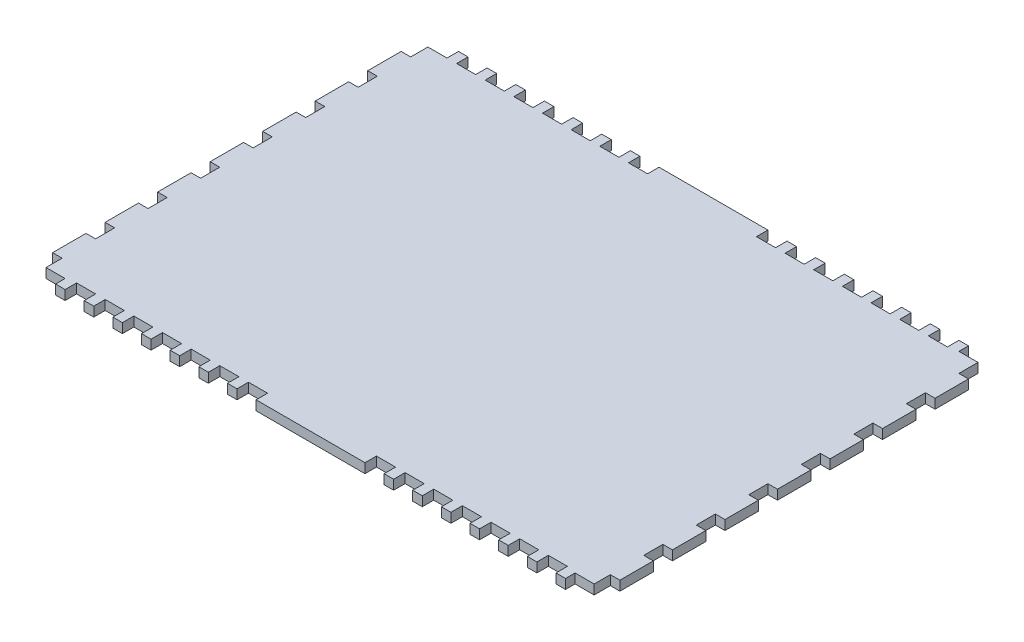
from build123d import *

# Parameters (mm, degrees)
ESQUISSE1_W                  = 297
ESQUISSE1_H                  = 210.950231097
BOSS_EXTRU_1_DEPTH           = 5
ESQUISSE2_W                  = 15
ESQUISSE2_H                  = 5
ENL_V_MAT_EXTRU_1_DEPTH      = 10
ESQUISSE3_W                  = 10
ESQUISSE3_H                  = 5
ESQUISSE3_H_2                = 1
ENL_V_MAT_EXTRU_2_DEPTH      = 10
R_P_TITION_LIN_AIRE1_COUNT   = 7
R_P_TITION_LIN_AIRE1_PITCH   = 15
SYM_TRIE1_COPY_1_SKETCH_W    = 10
SYM_TRIE1_COPY_1_SKETCH_H    = 5
SYM_TRIE1_COPY_1_SKETCH_H_2  = 1
SYM_TRIE1_COPY_1_DEPTH       = 10
SYM_TRIE1_COPY_2_SKETCH_W    = 10
SYM_TRIE1_COPY_2_SKETCH_H    = 5
SYM_TRIE1_COPY_2_SKETCH_H_2  = 1
SYM_TRIE1_COPY_2_DEPTH       = 10
SYM_TRIE1_COPY_3_SKETCH_W    = 10
SYM_TRIE1_COPY_3_SKETCH_H    = 5
SYM_TRIE1_COPY_3_SKETCH_H_2  = 1
SYM_TRIE1_COPY_3_DEPTH       = 10
SYM_TRIE1_COPY_4_SKETCH_W    = 10
SYM_TRIE1_COPY_4_SKETCH_H    = 5
SYM_TRIE1_COPY_4_SKETCH_H_2  = 1
SYM_TRIE1_COPY_4_DEPTH       = 10
SYM_TRIE1_COPY_5_SKETCH_W    = 10
SYM_TRIE1_COPY_5_SKETCH_H    = 5
SYM_TRIE1_COPY_5_SKETCH_H_2  = 1
SYM_TRIE1_COPY_5_DEPTH       = 10
SYM_TRIE1_COPY_6_SKETCH_W    = 10
SYM_TRIE1_COPY_6_SKETCH_H    = 5
SYM_TRIE1_COPY_6_SKETCH_H_2  = 1
SYM_TRIE1_COPY_6_DEPTH       = 10
SYM_TRIE2_COPY_1_SKETCH_W    = 10
SYM_TRIE2_COPY_1_SKETCH_H    = 5
SYM_TRIE2_COPY_1_SKETCH_H_2  = 1
SYM_TRIE2_COPY_1_DEPTH       = 10
SYM_TRIE2_COPY_2_SKETCH_W    = 10
SYM_TRIE2_COPY_2_SKETCH_H    = 5
SYM_TRIE2_COPY_2_SKETCH_H_2  = 1
SYM_TRIE2_COPY_2_DEPTH       = 10
SYM_TRIE2_COPY_3_SKETCH_W    = 10
SYM_TRIE2_COPY_3_SKETCH_H    = 5
SYM_TRIE2_COPY_3_SKETCH_H_2  = 1
SYM_TRIE2_COPY_3_DEPTH       = 10
SYM_TRIE2_COPY_4_SKETCH_W    = 10
SYM_TRIE2_COPY_4_SKETCH_H    = 5
SYM_TRIE2_COPY_4_SKETCH_H_2  = 1
SYM_TRIE2_COPY_4_DEPTH       = 10
SYM_TRIE2_COPY_5_SKETCH_W    = 10
SYM_TRIE2_COPY_5_SKETCH_H    = 5
SYM_TRIE2_COPY_5_SKETCH_H_2  = 1
SYM_TRIE2_COPY_5_DEPTH       = 10
SYM_TRIE2_COPY_6_SKETCH_W    = 10
SYM_TRIE2_COPY_6_SKETCH_H    = 5
SYM_TRIE2_COPY_6_SKETCH_H_2  = 1
SYM_TRIE2_COPY_6_DEPTH       = 10
SYM_TRIE2_COPY_7_SKETCH_W    = 15
SYM_TRIE2_COPY_7_SKETCH_H    = 5
SYM_TRIE2_COPY_7_DEPTH       = 10
SYM_TRIE2_COPY_8_SKETCH_W    = 10
SYM_TRIE2_COPY_8_SKETCH_H    = 5
SYM_TRIE2_COPY_8_SKETCH_H_2  = 1
SYM_TRIE2_COPY_8_DEPTH       = 10
SYM_TRIE2_COPY_9_SKETCH_W    = 10
SYM_TRIE2_COPY_9_SKETCH_H    = 5
SYM_TRIE2_COPY_9_SKETCH_H_2  = 1
SYM_TRIE2_COPY_9_DEPTH       = 10
SYM_TRIE2_COPY_10_SKETCH_W   = 10
SYM_TRIE2_COPY_10_SKETCH_H   = 5
SYM_TRIE2_COPY_10_SKETCH_H_2 = 1
SYM_TRIE2_COPY_10_DEPTH      = 10
SYM_TRIE2_COPY_11_SKETCH_W   = 10
SYM_TRIE2_COPY_11_SKETCH_H   = 5
SYM_TRIE2_COPY_11_SKETCH_H_2 = 1
SYM_TRIE2_COPY_11_DEPTH      = 10
SYM_TRIE2_COPY_12_SKETCH_W   = 10
SYM_TRIE2_COPY_12_SKETCH_H   = 5
SYM_TRIE2_COPY_12_SKETCH_H_2 = 1
SYM_TRIE2_COPY_12_DEPTH      = 10
SYM_TRIE2_COPY_13_SKETCH_W   = 10
SYM_TRIE2_COPY_13_SKETCH_H   = 5
SYM_TRIE2_COPY_13_SKETCH_H_2 = 1
SYM_TRIE2_COPY_13_DEPTH      = 10
SYM_TRIE2_COPY_14_SKETCH_W   = 10
SYM_TRIE2_COPY_14_SKETCH_H   = 5
SYM_TRIE2_COPY_14_SKETCH_H_2 = 1
SYM_TRIE2_COPY_14_DEPTH      = 10
ESQUISSE4_W                  = 5
ESQUISSE4_H                  = 10
ENL_V_MAT_EXTRU_3_DEPTH      = 10
R_P_TITION_LIN_AIRE2_COUNT   = 8
R_P_TITION_LIN_AIRE2_PITCH   = 27.5
SYM_TRIE3_COPY_1_SKETCH_W    = 5
SYM_TRIE3_COPY_1_SKETCH_H    = 10
SYM_TRIE3_COPY_1_DEPTH       = 10
SYM_TRIE3_COPY_2_SKETCH_W    = 5
SYM_TRIE3_COPY_2_SKETCH_H    = 10
SYM_TRIE3_COPY_2_DEPTH       = 10
SYM_TRIE3_COPY_3_SKETCH_W    = 5
SYM_TRIE3_COPY_3_SKETCH_H    = 10
SYM_TRIE3_COPY_3_DEPTH       = 10
SYM_TRIE3_COPY_4_SKETCH_W    = 5
SYM_TRIE3_COPY_4_SKETCH_H    = 10
SYM_TRIE3_COPY_4_DEPTH       = 10
SYM_TRIE3_COPY_5_SKETCH_W    = 5
SYM_TRIE3_COPY_5_SKETCH_H    = 10
SYM_TRIE3_COPY_5_DEPTH       = 10
SYM_TRIE3_COPY_6_SKETCH_W    = 5
SYM_TRIE3_COPY_6_SKETCH_H    = 10
SYM_TRIE3_COPY_6_DEPTH       = 10
SYM_TRIE3_COPY_7_SKETCH_W    = 5
SYM_TRIE3_COPY_7_SKETCH_H    = 10
SYM_TRIE3_COPY_7_DEPTH       = 10
ESQUISSE5_W                  = 10
ESQUISSE5_H                  = 1
ENL_V_MAT_EXTRU_4_DEPTH      = 10


with BuildPart() as part:
    # Esquisse1 → Boss.-Extru.1 (new body)
    with BuildSketch(Plane(origin=(0, 0, 0), x_dir=(1, 0, 0), z_dir=(0, 1, 0))):
        with Locations((109.551369972, 83.395955852)):
            Rectangle(ESQUISSE1_W, ESQUISSE1_H)
    extrude(amount=BOSS_EXTRU_1_DEPTH)

    # Esquisse2 → Enlèv. mat.-Extru.1 (cut)
    with BuildSketch(Plane(origin=(0, 0, 0), x_dir=(-1, 0, 0), z_dir=(0, -1, 0))):
        with Locations((31.448630028, -19.579159697)):
            Rectangle(ESQUISSE2_W, ESQUISSE2_H)
    enl_v_mat_extru_1 = extrude(amount=-ENL_V_MAT_EXTRU_1_DEPTH, mode=Mode.SUBTRACT)

    # Esquisse3 → Enlèv. mat.-Extru.2 (cut)
    with BuildSketch(Plane.XZ):
        with Locations((-13.948630028, 19.579159697)):
            Rectangle(ESQUISSE3_W, ESQUISSE3_H)
        with Locations((-13.948630028, 16.579159697)):
            Rectangle(ESQUISSE3_W, ESQUISSE3_H_2)
    enl_v_mat_extru_2 = extrude(amount=-ENL_V_MAT_EXTRU_2_DEPTH, mode=Mode.SUBTRACT)

    # Répétition linéaire1: Enlèv. mat.-Extru.2 ×7
    with Locations(*[(i * R_P_TITION_LIN_AIRE1_PITCH, 0, 0) for i in range(1, R_P_TITION_LIN_AIRE1_COUNT)]):
        add(enl_v_mat_extru_2, mode=Mode.SUBTRACT)

    # Symétrie1: Enlèv. mat.-Extru.1, Enlèv. mat.-Extru.2 across plane
    add(enl_v_mat_extru_1.mirror(Plane(origin=(109.551369972, 0, 0), x_dir=(0, 0, 1), z_dir=(1, 0, 0))), mode=Mode.SUBTRACT)
    add(enl_v_mat_extru_2.mirror(Plane(origin=(109.551369972, 0, 0), x_dir=(0, 0, 1), z_dir=(1, 0, 0))), mode=Mode.SUBTRACT)

    # Symétrie1 copy 1 sketch → Symétrie1 copy 1 (cut)
    with BuildSketch(Plane(origin=(204.102739944, 0, 0), x_dir=(-1, 0, 0), z_dir=(0, -1, 0))):
        with Locations((-13.948630028, -19.579159697)):
            Rectangle(SYM_TRIE1_COPY_1_SKETCH_W, SYM_TRIE1_COPY_1_SKETCH_H)
        with Locations((-13.948630028, -16.579159697)):
            Rectangle(SYM_TRIE1_COPY_1_SKETCH_W, SYM_TRIE1_COPY_1_SKETCH_H_2)
    extrude(amount=-SYM_TRIE1_COPY_1_DEPTH, mode=Mode.SUBTRACT)

    # Symétrie1 copy 2 sketch → Symétrie1 copy 2 (cut)
    with BuildSketch(Plane(origin=(189.102739944, 0, 0), x_dir=(-1, 0, 0), z_dir=(0, -1, 0))):
        with Locations((-13.948630028, -19.579159697)):
            Rectangle(SYM_TRIE1_COPY_2_SKETCH_W, SYM_TRIE1_COPY_2_SKETCH_H)
        with Locations((-13.948630028, -16.579159697)):
            Rectangle(SYM_TRIE1_COPY_2_SKETCH_W, SYM_TRIE1_COPY_2_SKETCH_H_2)
    extrude(amount=-SYM_TRIE1_COPY_2_DEPTH, mode=Mode.SUBTRACT)

    # Symétrie1 copy 3 sketch → Symétrie1 copy 3 (cut)
    with BuildSketch(Plane(origin=(174.102739944, 0, 0), x_dir=(-1, 0, 0), z_dir=(0, -1, 0))):
        with Locations((-13.948630028, -19.579159697)):
            Rectangle(SYM_TRIE1_COPY_3_SKETCH_W, SYM_TRIE1_COPY_3_SKETCH_H)
        with Locations((-13.948630028, -16.579159697)):
            Rectangle(SYM_TRIE1_COPY_3_SKETCH_W, SYM_TRIE1_COPY_3_SKETCH_H_2)
    extrude(amount=-SYM_TRIE1_COPY_3_DEPTH, mode=Mode.SUBTRACT)

    # Symétrie1 copy 4 sketch → Symétrie1 copy 4 (cut)
    with BuildSketch(Plane(origin=(159.102739944, 0, 0), x_dir=(-1, 0, 0), z_dir=(0, -1, 0))):
        with Locations((-13.948630028, -19.579159697)):
            Rectangle(SYM_TRIE1_COPY_4_SKETCH_W, SYM_TRIE1_COPY_4_SKETCH_H)
        with Locations((-13.948630028, -16.579159697)):
            Rectangle(SYM_TRIE1_COPY_4_SKETCH_W, SYM_TRIE1_COPY_4_SKETCH_H_2)
    extrude(amount=-SYM_TRIE1_COPY_4_DEPTH, mode=Mode.SUBTRACT)

    # Symétrie1 copy 5 sketch → Symétrie1 copy 5 (cut)
    with BuildSketch(Plane(origin=(144.102739944, 0, 0), x_dir=(-1, 0, 0), z_dir=(0, -1, 0))):
        with Locations((-13.948630028, -19.579159697)):
            Rectangle(SYM_TRIE1_COPY_5_SKETCH_W, SYM_TRIE1_COPY_5_SKETCH_H)
        with Locations((-13.948630028, -16.579159697)):
            Rectangle(SYM_TRIE1_COPY_5_SKETCH_W, SYM_TRIE1_COPY_5_SKETCH_H_2)
    extrude(amount=-SYM_TRIE1_COPY_5_DEPTH, mode=Mode.SUBTRACT)

    # Symétrie1 copy 6 sketch → Symétrie1 copy 6 (cut)
    with BuildSketch(Plane(origin=(129.102739944, 0, 0), x_dir=(-1, 0, 0), z_dir=(0, -1, 0))):
        with Locations((-13.948630028, -19.579159697)):
            Rectangle(SYM_TRIE1_COPY_6_SKETCH_W, SYM_TRIE1_COPY_6_SKETCH_H)
        with Locations((-13.948630028, -16.579159697)):
            Rectangle(SYM_TRIE1_COPY_6_SKETCH_W, SYM_TRIE1_COPY_6_SKETCH_H_2)
    extrude(amount=-SYM_TRIE1_COPY_6_DEPTH, mode=Mode.SUBTRACT)

    # Symétrie2: Enlèv. mat.-Extru.1, Enlèv. mat.-Extru.2 across plane
    add(enl_v_mat_extru_1.mirror(Plane.XY.offset(-83.395955851)), mode=Mode.SUBTRACT)
    add(enl_v_mat_extru_2.mirror(Plane.XY.offset(-83.395955851)), mode=Mode.SUBTRACT)

    # Symétrie2 copy 1 sketch → Symétrie2 copy 1 (cut)
    with BuildSketch(Plane(origin=(15, 0, -166.791911703), x_dir=(1, 0, 0), z_dir=(0, -1, 0))):
        with Locations((-13.948630028, -19.579159697)):
            Rectangle(SYM_TRIE2_COPY_1_SKETCH_W, SYM_TRIE2_COPY_1_SKETCH_H)
        with Locations((-13.948630028, -16.579159697)):
            Rectangle(SYM_TRIE2_COPY_1_SKETCH_W, SYM_TRIE2_COPY_1_SKETCH_H_2)
    extrude(amount=-SYM_TRIE2_COPY_1_DEPTH, mode=Mode.SUBTRACT)

    # Symétrie2 copy 2 sketch → Symétrie2 copy 2 (cut)
    with BuildSketch(Plane(origin=(30, 0, -166.791911703), x_dir=(1, 0, 0), z_dir=(0, -1, 0))):
        with Locations((-13.948630028, -19.579159697)):
            Rectangle(SYM_TRIE2_COPY_2_SKETCH_W, SYM_TRIE2_COPY_2_SKETCH_H)
        with Locations((-13.948630028, -16.579159697)):
            Rectangle(SYM_TRIE2_COPY_2_SKETCH_W, SYM_TRIE2_COPY_2_SKETCH_H_2)
    extrude(amount=-SYM_TRIE2_COPY_2_DEPTH, mode=Mode.SUBTRACT)

    # Symétrie2 copy 3 sketch → Symétrie2 copy 3 (cut)
    with BuildSketch(Plane(origin=(45, 0, -166.791911703), x_dir=(1, 0, 0), z_dir=(0, -1, 0))):
        with Locations((-13.948630028, -19.579159697)):
            Rectangle(SYM_TRIE2_COPY_3_SKETCH_W, SYM_TRIE2_COPY_3_SKETCH_H)
        with Locations((-13.948630028, -16.579159697)):
            Rectangle(SYM_TRIE2_COPY_3_SKETCH_W, SYM_TRIE2_COPY_3_SKETCH_H_2)
    extrude(amount=-SYM_TRIE2_COPY_3_DEPTH, mode=Mode.SUBTRACT)

    # Symétrie2 copy 4 sketch → Symétrie2 copy 4 (cut)
    with BuildSketch(Plane(origin=(60, 0, -166.791911703), x_dir=(1, 0, 0), z_dir=(0, -1, 0))):
        with Locations((-13.948630028, -19.579159697)):
            Rectangle(SYM_TRIE2_COPY_4_SKETCH_W, SYM_TRIE2_COPY_4_SKETCH_H)
        with Locations((-13.948630028, -16.579159697)):
            Rectangle(SYM_TRIE2_COPY_4_SKETCH_W, SYM_TRIE2_COPY_4_SKETCH_H_2)
    extrude(amount=-SYM_TRIE2_COPY_4_DEPTH, mode=Mode.SUBTRACT)

    # Symétrie2 copy 5 sketch → Symétrie2 copy 5 (cut)
    with BuildSketch(Plane(origin=(75, 0, -166.791911703), x_dir=(1, 0, 0), z_dir=(0, -1, 0))):
        with Locations((-13.948630028, -19.579159697)):
            Rectangle(SYM_TRIE2_COPY_5_SKETCH_W, SYM_TRIE2_COPY_5_SKETCH_H)
        with Locations((-13.948630028, -16.579159697)):
            Rectangle(SYM_TRIE2_COPY_5_SKETCH_W, SYM_TRIE2_COPY_5_SKETCH_H_2)
    extrude(amount=-SYM_TRIE2_COPY_5_DEPTH, mode=Mode.SUBTRACT)

    # Symétrie2 copy 6 sketch → Symétrie2 copy 6 (cut)
    with BuildSketch(Plane(origin=(90, 0, -166.791911703), x_dir=(1, 0, 0), z_dir=(0, -1, 0))):
        with Locations((-13.948630028, -19.579159697)):
            Rectangle(SYM_TRIE2_COPY_6_SKETCH_W, SYM_TRIE2_COPY_6_SKETCH_H)
        with Locations((-13.948630028, -16.579159697)):
            Rectangle(SYM_TRIE2_COPY_6_SKETCH_W, SYM_TRIE2_COPY_6_SKETCH_H_2)
    extrude(amount=-SYM_TRIE2_COPY_6_DEPTH, mode=Mode.SUBTRACT)

    # Symétrie2 copy 7 sketch → Symétrie2 copy 7 (cut)
    with BuildSketch(Plane(origin=(219.102739944, 0, -166.791911703), x_dir=(1, 0, 0), z_dir=(0, -1, 0))):
        with Locations((31.448630028, -19.579159697)):
            Rectangle(SYM_TRIE2_COPY_7_SKETCH_W, SYM_TRIE2_COPY_7_SKETCH_H)
    extrude(amount=-SYM_TRIE2_COPY_7_DEPTH, mode=Mode.SUBTRACT)

    # Symétrie2 copy 8 sketch → Symétrie2 copy 8 (cut)
    with BuildSketch(Plane(origin=(219.102739944, 0, -166.791911703), x_dir=(-1, 0, 0), z_dir=(0, -1, 0))):
        with Locations((-13.948630028, 19.579159697)):
            Rectangle(SYM_TRIE2_COPY_8_SKETCH_W, SYM_TRIE2_COPY_8_SKETCH_H)
        with Locations((-13.948630028, 16.579159697)):
            Rectangle(SYM_TRIE2_COPY_8_SKETCH_W, SYM_TRIE2_COPY_8_SKETCH_H_2)
    extrude(amount=-SYM_TRIE2_COPY_8_DEPTH, mode=Mode.SUBTRACT)

    # Symétrie2 copy 9 sketch → Symétrie2 copy 9 (cut)
    with BuildSketch(Plane(origin=(204.102739944, 0, -166.791911703), x_dir=(-1, 0, 0), z_dir=(0, -1, 0))):
        with Locations((-13.948630028, 19.579159697)):
            Rectangle(SYM_TRIE2_COPY_9_SKETCH_W, SYM_TRIE2_COPY_9_SKETCH_H)
        with Locations((-13.948630028, 16.579159697)):
            Rectangle(SYM_TRIE2_COPY_9_SKETCH_W, SYM_TRIE2_COPY_9_SKETCH_H_2)
    extrude(amount=-SYM_TRIE2_COPY_9_DEPTH, mode=Mode.SUBTRACT)

    # Symétrie2 copy 10 sketch → Symétrie2 copy 10 (cut)
    with BuildSketch(Plane(origin=(189.102739944, 0, -166.791911703), x_dir=(-1, 0, 0), z_dir=(0, -1, 0))):
        with Locations((-13.948630028, 19.579159697)):
            Rectangle(SYM_TRIE2_COPY_10_SKETCH_W, SYM_TRIE2_COPY_10_SKETCH_H)
        with Locations((-13.948630028, 16.579159697)):
            Rectangle(SYM_TRIE2_COPY_10_SKETCH_W, SYM_TRIE2_COPY_10_SKETCH_H_2)
    extrude(amount=-SYM_TRIE2_COPY_10_DEPTH, mode=Mode.SUBTRACT)

    # Symétrie2 copy 11 sketch → Symétrie2 copy 11 (cut)
    with BuildSketch(Plane(origin=(174.102739944, 0, -166.791911703), x_dir=(-1, 0, 0), z_dir=(0, -1, 0))):
        with Locations((-13.948630028, 19.579159697)):
            Rectangle(SYM_TRIE2_COPY_11_SKETCH_W, SYM_TRIE2_COPY_11_SKETCH_H)
        with Locations((-13.948630028, 16.579159697)):
            Rectangle(SYM_TRIE2_COPY_11_SKETCH_W, SYM_TRIE2_COPY_11_SKETCH_H_2)
    extrude(amount=-SYM_TRIE2_COPY_11_DEPTH, mode=Mode.SUBTRACT)

    # Symétrie2 copy 12 sketch → Symétrie2 copy 12 (cut)
    with BuildSketch(Plane(origin=(159.102739944, 0, -166.791911703), x_dir=(-1, 0, 0), z_dir=(0, -1, 0))):
        with Locations((-13.948630028, 19.579159697)):
            Rectangle(SYM_TRIE2_COPY_12_SKETCH_W, SYM_TRIE2_COPY_12_SKETCH_H)
        with Locations((-13.948630028, 16.579159697)):
            Rectangle(SYM_TRIE2_COPY_12_SKETCH_W, SYM_TRIE2_COPY_12_SKETCH_H_2)
    extrude(amount=-SYM_TRIE2_COPY_12_DEPTH, mode=Mode.SUBTRACT)

    # Symétrie2 copy 13 sketch → Symétrie2 copy 13 (cut)
    with BuildSketch(Plane(origin=(144.102739944, 0, -166.791911703), x_dir=(-1, 0, 0), z_dir=(0, -1, 0))):
        with Locations((-13.948630028, 19.579159697)):
            Rectangle(SYM_TRIE2_COPY_13_SKETCH_W, SYM_TRIE2_COPY_13_SKETCH_H)
        with Locations((-13.948630028, 16.579159697)):
            Rectangle(SYM_TRIE2_COPY_13_SKETCH_W, SYM_TRIE2_COPY_13_SKETCH_H_2)
    extrude(amount=-SYM_TRIE2_COPY_13_DEPTH, mode=Mode.SUBTRACT)

    # Symétrie2 copy 14 sketch → Symétrie2 copy 14 (cut)
    with BuildSketch(Plane(origin=(129.102739944, 0, -166.791911703), x_dir=(-1, 0, 0), z_dir=(0, -1, 0))):
        with Locations((-13.948630028, 19.579159697)):
            Rectangle(SYM_TRIE2_COPY_14_SKETCH_W, SYM_TRIE2_COPY_14_SKETCH_H)
        with Locations((-13.948630028, 16.579159697)):
            Rectangle(SYM_TRIE2_COPY_14_SKETCH_W, SYM_TRIE2_COPY_14_SKETCH_H_2)
    extrude(amount=-SYM_TRIE2_COPY_14_DEPTH, mode=Mode.SUBTRACT)

    # Esquisse4 → Enlèv. mat.-Extru.3 (cut)
    with BuildSketch(Plane(origin=(0, 0, 0), x_dir=(-1, 0, 0), z_dir=(0, -1, 0))):
        with Locations((36.448630028, 178.8710714)):
            Rectangle(ESQUISSE4_W, ESQUISSE4_H)
    enl_v_mat_extru_3 = extrude(amount=-ENL_V_MAT_EXTRU_3_DEPTH, mode=Mode.SUBTRACT)

    # Répétition linéaire2: Enlèv. mat.-Extru.3 ×8
    with Locations(*[(0, 0, i * R_P_TITION_LIN_AIRE2_PITCH) for i in range(1, R_P_TITION_LIN_AIRE2_COUNT)]):
        add(enl_v_mat_extru_3, mode=Mode.SUBTRACT)

    # Symétrie3: Enlèv. mat.-Extru.3 across plane
    add(enl_v_mat_extru_3.mirror(Plane.ZY.offset(-109.551369972)), mode=Mode.SUBTRACT)

    # Symétrie3 copy 1 sketch → Symétrie3 copy 1 (cut)
    with BuildSketch(Plane(origin=(219.102739944, 0, 27.5), x_dir=(1, 0, 0), z_dir=(0, -1, 0))):
        with Locations((36.448630028, -178.8710714)):
            Rectangle(SYM_TRIE3_COPY_1_SKETCH_W, SYM_TRIE3_COPY_1_SKETCH_H)
    extrude(amount=-SYM_TRIE3_COPY_1_DEPTH, mode=Mode.SUBTRACT)

    # Symétrie3 copy 2 sketch → Symétrie3 copy 2 (cut)
    with BuildSketch(Plane(origin=(219.102739944, 0, 55), x_dir=(1, 0, 0), z_dir=(0, -1, 0))):
        with Locations((36.448630028, -178.8710714)):
            Rectangle(SYM_TRIE3_COPY_2_SKETCH_W, SYM_TRIE3_COPY_2_SKETCH_H)
    extrude(amount=-SYM_TRIE3_COPY_2_DEPTH, mode=Mode.SUBTRACT)

    # Symétrie3 copy 3 sketch → Symétrie3 copy 3 (cut)
    with BuildSketch(Plane(origin=(219.102739944, 0, 82.5), x_dir=(1, 0, 0), z_dir=(0, -1, 0))):
        with Locations((36.448630028, -178.8710714)):
            Rectangle(SYM_TRIE3_COPY_3_SKETCH_W, SYM_TRIE3_COPY_3_SKETCH_H)
    extrude(amount=-SYM_TRIE3_COPY_3_DEPTH, mode=Mode.SUBTRACT)

    # Symétrie3 copy 4 sketch → Symétrie3 copy 4 (cut)
    with BuildSketch(Plane(origin=(219.102739944, 0, 110), x_dir=(1, 0, 0), z_dir=(0, -1, 0))):
        with Locations((36.448630028, -178.8710714)):
            Rectangle(SYM_TRIE3_COPY_4_SKETCH_W, SYM_TRIE3_COPY_4_SKETCH_H)
    extrude(amount=-SYM_TRIE3_COPY_4_DEPTH, mode=Mode.SUBTRACT)

    # Symétrie3 copy 5 sketch → Symétrie3 copy 5 (cut)
    with BuildSketch(Plane(origin=(219.102739944, 0, 137.5), x_dir=(1, 0, 0), z_dir=(0, -1, 0))):
        with Locations((36.448630028, -178.8710714)):
            Rectangle(SYM_TRIE3_COPY_5_SKETCH_W, SYM_TRIE3_COPY_5_SKETCH_H)
    extrude(amount=-SYM_TRIE3_COPY_5_DEPTH, mode=Mode.SUBTRACT)

    # Symétrie3 copy 6 sketch → Symétrie3 copy 6 (cut)
    with BuildSketch(Plane(origin=(219.102739944, 0, 165), x_dir=(1, 0, 0), z_dir=(0, -1, 0))):
        with Locations((36.448630028, -178.8710714)):
            Rectangle(SYM_TRIE3_COPY_6_SKETCH_W, SYM_TRIE3_COPY_6_SKETCH_H)
    extrude(amount=-SYM_TRIE3_COPY_6_DEPTH, mode=Mode.SUBTRACT)

    # Symétrie3 copy 7 sketch → Symétrie3 copy 7 (cut)
    with BuildSketch(Plane(origin=(219.102739944, 0, 192.5), x_dir=(1, 0, 0), z_dir=(0, -1, 0))):
        with Locations((36.448630028, -178.8710714)):
            Rectangle(SYM_TRIE3_COPY_7_SKETCH_W, SYM_TRIE3_COPY_7_SKETCH_H)
    extrude(amount=-SYM_TRIE3_COPY_7_DEPTH, mode=Mode.SUBTRACT)

    # Esquisse5 → Enlèv. mat.-Extru.4 (cut)
    with BuildSketch(Plane.XZ):
        with Locations((-28.948630028, -183.3710714)):
            Rectangle(ESQUISSE5_W, ESQUISSE5_H)
    extrude(amount=-ENL_V_MAT_EXTRU_4_DEPTH, mode=Mode.SUBTRACT)


solid = part.part
